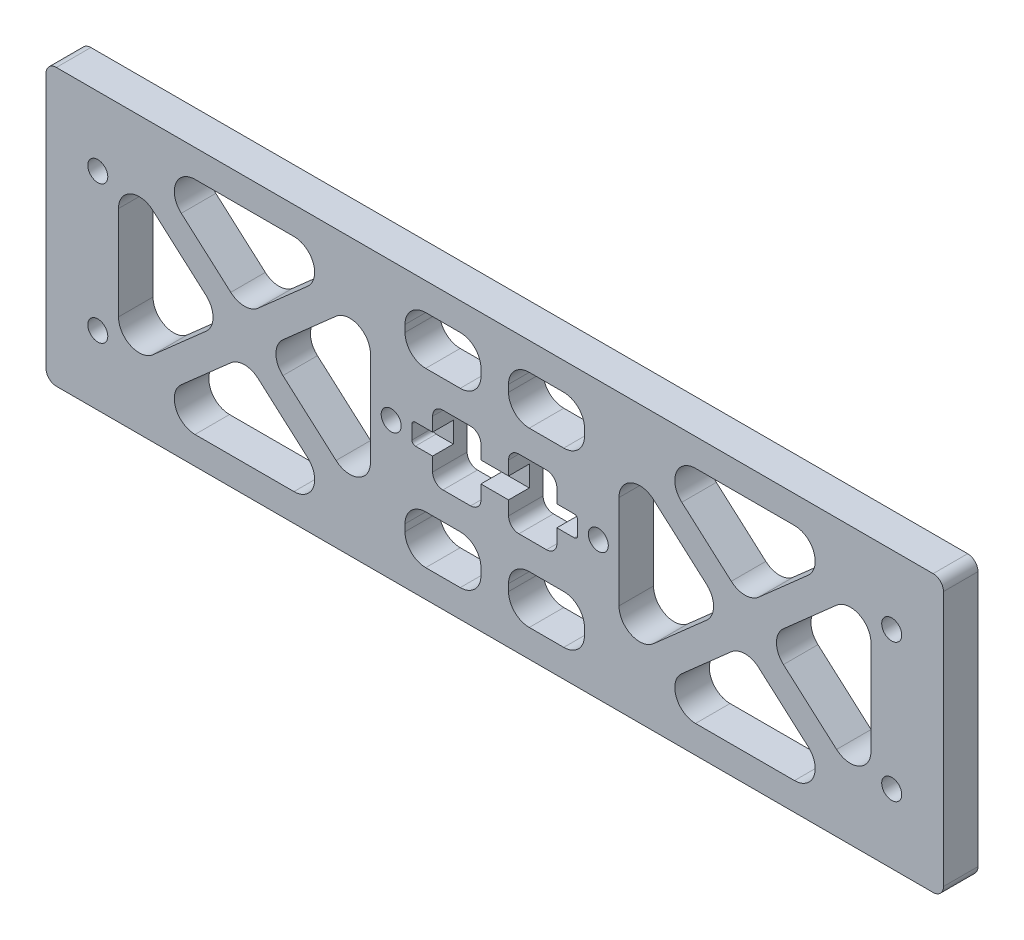
from build123d import *

# Parameters (mm, degrees)
SKETCH_1_W          = 130
SKETCH_1_H          = 40
SKETCH_1_R          = 1.45
EXTRUDE_1_DEPTH     = 5
SKETCH_3_W          = 24
SKETCH_3_H          = 3
CUT_EXTRUDE_1_DEPTH = 3
SKETCH_4_W          = 7
SKETCH_4_H          = 10
CUT_EXTRUDE_2_DEPTH = 69.190908485
SKETCH_5_W          = 11
SKETCH_5_H          = 7
CUT_EXTRUDE_3_DEPTH = 69.190908485
FILLET_1_R          = 3
FILLET_2_R          = 1.5
FILLET_3_R          = 1.5
FILLET_4_R          = 0.5


with BuildPart() as part:
    # 草图1 → 凸台-拉伸1 (new body)
    with BuildSketch(Plane.XY):
        Rectangle(SKETCH_1_W, SKETCH_1_H)
        with Locations((-57.5, -10)):
            Circle(SKETCH_1_R, mode=Mode.SUBTRACT)
        with Locations((-57.5, 10)):
            Circle(SKETCH_1_R, mode=Mode.SUBTRACT)
        with Locations(Location((57.5, -10, 0), (0, 0, 180))):
            Circle(SKETCH_1_R, mode=Mode.SUBTRACT)
        with Locations(Location((57.5, 10, 0), (0, 0, 180))):
            Circle(SKETCH_1_R, mode=Mode.SUBTRACT)
        with Locations((-15, 0)):
            Circle(SKETCH_1_R, mode=Mode.SUBTRACT)
        with Locations((15, 0)):
            Circle(SKETCH_1_R, mode=Mode.SUBTRACT)
    extrude(amount=EXTRUDE_1_DEPTH)

    # 草图3 → 切除-拉伸1 (cut)
    with BuildSketch(Plane.XY.offset(5)):
        Rectangle(SKETCH_3_W, SKETCH_3_H)
    extrude(amount=-CUT_EXTRUDE_1_DEPTH, mode=Mode.SUBTRACT)

    # 草图4 → 切除-拉伸2 (cut, through all)
    with BuildSketch(Plane.XY.offset(5)):
        with Locations((-5.5, 0)):
            Rectangle(SKETCH_4_W, SKETCH_4_H)
        with Locations((5.5, 0)):
            Rectangle(SKETCH_4_W, SKETCH_4_H)
    extrude(amount=-CUT_EXTRUDE_2_DEPTH, mode=Mode.SUBTRACT)

    # 草图5 → 切除-拉伸3 (cut, through all)
    with BuildSketch(Plane.XY.offset(5)):
        Polygon((-51.346241304, 16), (-36.25, 2.668254433), (-21.153758696, 16), align=None)
        Polygon((-54.5, 13.448628684), (-39.271405755, 0), (-54.5, -13.448628684), align=None)
        Polygon((-18, 13.448628684), (-18, -13.448628684), (-33.228594245, 0), align=None)
        Polygon((-51.346241304, -16), (-21.153758696, -16), (-36.25, -2.668254433), align=None)
        with Locations((-7.5, 12.5)):
            Rectangle(SKETCH_5_W, SKETCH_5_H)
        with Locations((-7.5, -12.5)):
            Rectangle(SKETCH_5_W, SKETCH_5_H)
        with Locations((7.5, -12.5)):
            Rectangle(SKETCH_5_W, SKETCH_5_H)
        with Locations((7.5, 12.5)):
            Rectangle(SKETCH_5_W, SKETCH_5_H)
        Polygon((36.25, -2.668254433), (51.346241304, -16), (21.153758696, -16), align=None)
        Polygon((33.228594245, 0), (18, 13.448628684), (18, -13.448628684), align=None)
        Polygon((54.5, -13.448628684), (54.5, 13.448628684), (39.271405755, 0), align=None)
        Polygon((21.153758696, 16), (51.346241304, 16), (36.25, 2.668254433), align=None)
    extrude(amount=-CUT_EXTRUDE_3_DEPTH, mode=Mode.SUBTRACT)

    # 圆角1
    fillet_1_edges = [part.edges().sort_by_distance(p)[0] for p in [
        (-13, -16, 2.5),
        (-13, -9, 2.5),
        (-2, -9, 2.5),
        (-2, -16, 2.5),
        (13, 16, 2.5),
        (13, 9, 2.5),
        (2, 9, 2.5),
        (2, 16, 2.5),
        (2, -9, 2.5),
        (13, -9, 2.5),
        (13, -16, 2.5),
        (2, -16, 2.5),
        (21.153758696, -16, 2.5),
        (36.25, -2.668254433, 2.5),
        (51.346241304, -16, 2.5),
        (-51.346241304, 16, 2.5),
        (-21.153758696, 16, 2.5),
        (-36.25, 2.668254433, 2.5),
        (-2, 16, 2.5),
        (-2, 9, 2.5),
        (-13, 9, 2.5),
        (-13, 16, 2.5),
        (-51.346241304, -16, 2.5),
        (-36.25, -2.668254433, 2.5),
        (-21.153758696, -16, 2.5),
        (-18, -13.448628684, 2.5),
        (-33.228594245, 0, 2.5),
        (-18, 13.448628684, 2.5),
        (36.25, 2.668254433, 2.5),
        (21.153758696, 16, 2.5),
        (51.346241304, 16, 2.5),
        (54.5, -13.448628684, 2.5),
        (39.271405755, 0, 2.5),
        (54.5, 13.448628684, 2.5),
        (33.228594245, 0, 2.5),
        (18, -13.448628684, 2.5),
        (18, 13.448628684, 2.5),
        (-54.5, -13.448628684, 2.5),
        (-54.5, 13.448628684, 2.5),
        (-39.271405755, 0, 2.5),
    ]]
    fillet(fillet_1_edges, radius=FILLET_1_R)

    # 圆角2
    fillet_2_edges = [part.edges().sort_by_distance(p)[0] for p in [
        (-2, 5, 2.5),
        (-9, -5, 2.5),
        (-2, -5, 2.5),
        (-9, 5, 2.5),
        (9, 5, 2.5),
        (2, -5, 2.5),
        (9, -5, 2.5),
        (2, 5, 2.5),
    ]]
    fillet(fillet_2_edges, radius=FILLET_2_R)

    # 圆角3
    fillet_3_edges = [part.edges().sort_by_distance(p)[0] for p in [
        (65, -20, 2.5),
        (-65, -20, 2.5),
        (-65, 20, 2.5),
        (65, 20, 2.5),
    ]]
    fillet(fillet_3_edges, radius=FILLET_3_R)

    # 圆角4
    fillet_4_edges = [part.edges().sort_by_distance(p)[0] for p in [
        (12, 1.5, 3.5),
        (12, -1.5, 3.5),
        (-12, -1.5, 3.5),
        (-12, 1.5, 3.5),
    ]]
    fillet(fillet_4_edges, radius=FILLET_4_R)


solid = part.part
